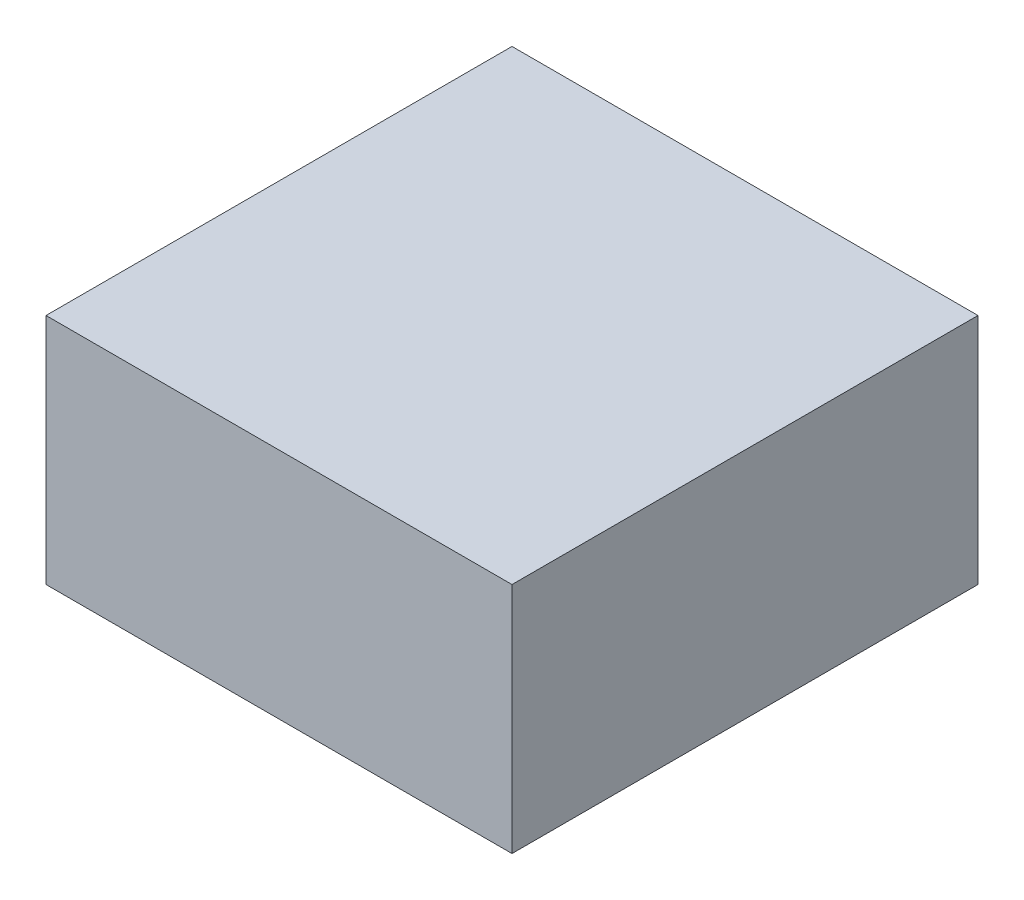
from build123d import *

# Parameters (mm, degrees)
SKETCH1_W           = 12.7
SKETCH1_H           = 12.7
BOSS_EXTRUDE1_DEPTH = 6.35


with BuildPart() as part:
    # Sketch1 → Boss-Extrude1 (new body)
    with BuildSketch(Plane(origin=(0, 0, 0), x_dir=(1, 0, 0), z_dir=(0, 1, 0))):
        Rectangle(SKETCH1_W, SKETCH1_H)
    extrude(amount=BOSS_EXTRUDE1_DEPTH)


solid = part.part
